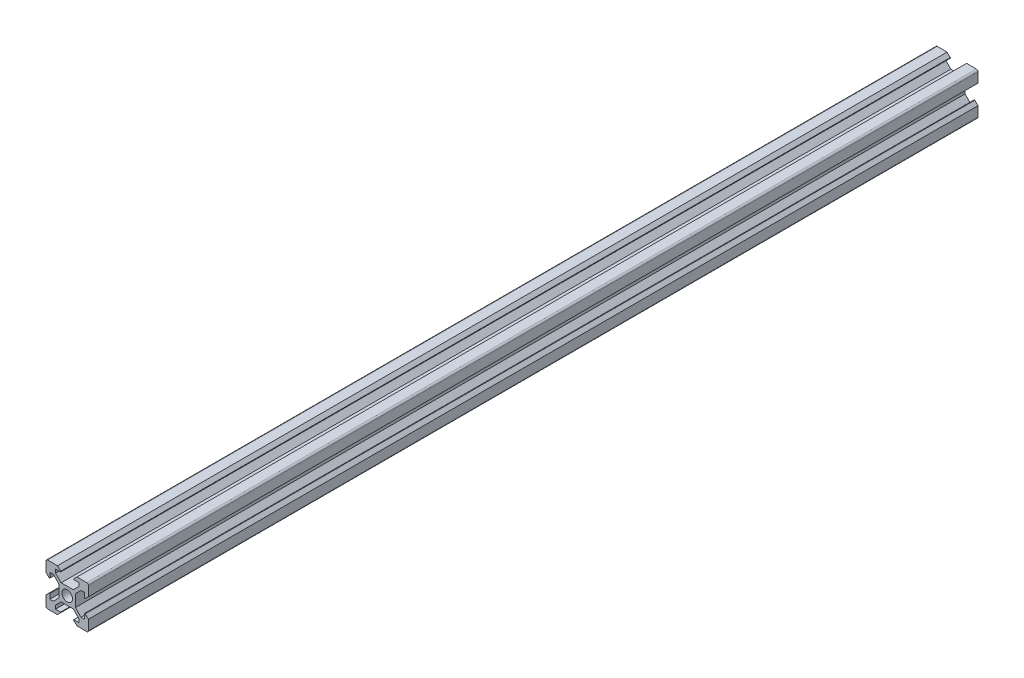
from build123d import *

# Parameters (mm, degrees)
CROQUIS1_R              = 2.5
SALIENTE_EXTRUIR1_DEPTH = 480
CUT_EXTRUDE1_DEPTH      = 46
CUT_EXTRUDE1_DEPTH_BACK = 54
SKETCH1_W               = 120
SKETCH1_H               = 24.218109802


with BuildPart() as part:
    # Croquis1 → Saliente-Extruir1 (new body)
    with BuildSketch(Plane.XY):
        with BuildLine():
            Line((-4.6, 10), (-3.1, 8.5))
            Line((-3.1, 8.5), (-3.1, 8.2))
            Line((-3.1, 8.2), (-5.5, 8.2))
            Line((-5.5, 8.2), (-5.5, 6.560660172))
            Line((-5.5, 6.560660172), (-2.84, 3.900660172))
            Line((-2.84, 3.900660172), (0, 3.900660172))
            Line((0, 3.900660172), (2.84, 3.900660172))
            Line((2.84, 3.900660172), (5.5, 6.560660172))
            Line((5.5, 6.560660172), (5.5, 8.2))
            Line((5.5, 8.2), (3.1, 8.2))
            Line((3.1, 8.2), (3.1, 8.5))
            Line((3.1, 8.5), (4.6, 10))
            Line((4.6, 10), (9.25, 10))
            ThreePointArc((9.25, 10), (9.780330086, 9.780330086), (10, 9.25))
            Line((10, 9.25), (10, 4.6))
            Line((10, 4.6), (8.5, 3.1))
            Line((8.5, 3.1), (8.2, 3.1))
            Line((8.2, 3.1), (8.2, 5.5))
            Line((8.2, 5.5), (6.560660172, 5.5))
            Line((6.560660172, 5.5), (3.900660172, 2.84))
            Line((3.900660172, 2.84), (3.900660172, 0))
            Line((3.900660172, 0), (3.900660172, -2.84))
            Line((3.900660172, -2.84), (6.560660172, -5.5))
            Line((6.560660172, -5.5), (8.2, -5.5))
            Line((8.2, -5.5), (8.2, -3.1))
            Line((8.2, -3.1), (8.5, -3.1))
            Line((8.5, -3.1), (10, -4.6))
            Line((10, -4.6), (10, -9.25))
            ThreePointArc((10, -9.25), (9.780330086, -9.780330086), (9.25, -10))
            Line((9.25, -10), (4.6, -10))
            Line((4.6, -10), (3.1, -8.5))
            Line((3.1, -8.5), (3.1, -8.2))
            Line((3.1, -8.2), (5.5, -8.2))
            Line((5.5, -8.2), (5.5, -6.560660172))
            Line((5.5, -6.560660172), (2.84, -3.900660172))
            Line((2.84, -3.900660172), (0, -3.900660172))
            Line((0, -3.900660172), (-2.84, -3.900660172))
            Line((-2.84, -3.900660172), (-5.5, -6.560660172))
            Line((-5.5, -6.560660172), (-5.5, -8.2))
            Line((-5.5, -8.2), (-3.1, -8.2))
            Line((-3.1, -8.2), (-3.1, -8.5))
            Line((-3.1, -8.5), (-4.6, -10))
            Line((-4.6, -10), (-9.25, -10))
            ThreePointArc((-9.25, -10), (-9.780330086, -9.780330086), (-10, -9.25))
            Line((-10, -9.25), (-10, -4.6))
            Line((-10, -4.6), (-8.5, -3.1))
            Line((-8.5, -3.1), (-8.2, -3.1))
            Line((-8.2, -3.1), (-8.2, -5.5))
            Line((-8.2, -5.5), (-6.560660172, -5.5))
            Line((-6.560660172, -5.5), (-3.900660172, -2.84))
            Line((-3.900660172, -2.84), (-3.900660172, 0))
            Line((-3.900660172, 0), (-3.900660172, 2.84))
            Line((-3.900660172, 2.84), (-6.560660172, 5.5))
            Line((-6.560660172, 5.5), (-8.2, 5.5))
            Line((-8.2, 5.5), (-8.2, 3.1))
            Line((-8.2, 3.1), (-8.5, 3.1))
            Line((-8.5, 3.1), (-10, 4.6))
            Line((-10, 4.6), (-10, 9.25))
            ThreePointArc((-10, 9.25), (-9.780330086, 9.780330086), (-9.25, 10))
            Line((-9.25, 10), (-4.6, 10))
        make_face()
        Circle(CROQUIS1_R, mode=Mode.SUBTRACT)
    extrude(amount=SALIENTE_EXTRUIR1_DEPTH)

    # Sketch1 → Cut-Extrude1 (cut, two sides: drawn at the far end of the back side and taken through both)
    with BuildSketch(Plane(origin=(0, 0, 0), x_dir=(0, 0, -1), z_dir=(1, 0, 0)).offset(-CUT_EXTRUDE1_DEPTH_BACK)):
        Rectangle(SKETCH1_W, SKETCH1_H)
    extrude(amount=CUT_EXTRUDE1_DEPTH + CUT_EXTRUDE1_DEPTH_BACK, mode=Mode.SUBTRACT)


solid = part.part
